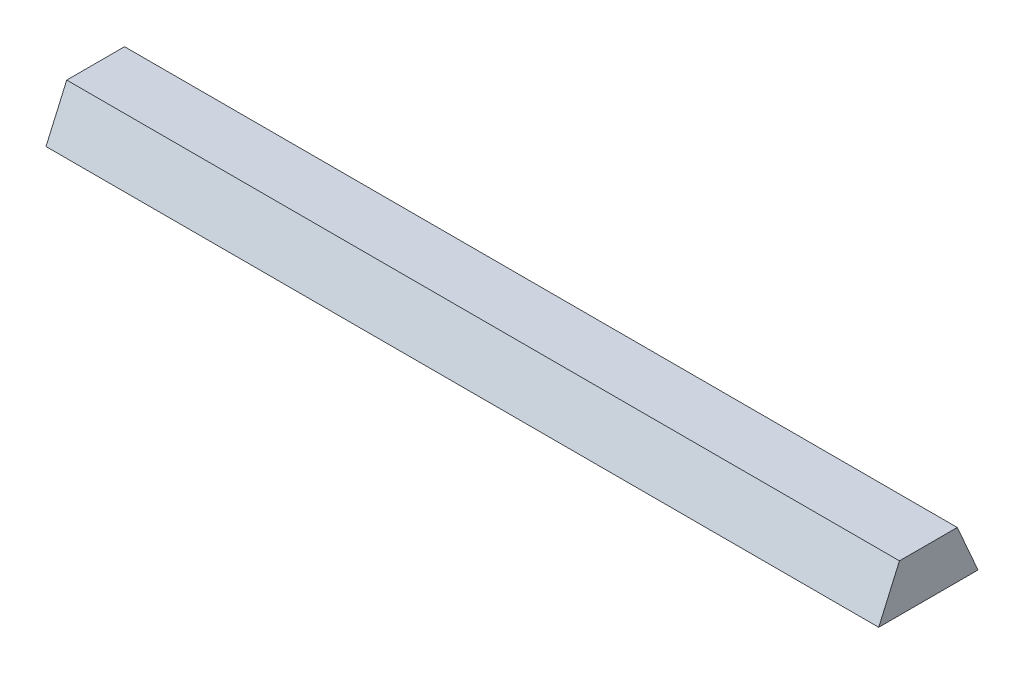
from build123d import *

# Parameters (mm, degrees)
SALIENTE_EXTRUIR1_DEPTH = 360


with BuildPart() as part:
    # Croquis1 → Saliente-Extruir1 (new body)
    with BuildSketch(Plane(origin=(0, 0, 0), x_dir=(0, 0, -1), z_dir=(1, 0, 0))):
        Polygon((-12.5, 20.406398165), (12.5, 20.406398165), (21.46, 0), (-21.46, 0), align=None)
    extrude(amount=SALIENTE_EXTRUIR1_DEPTH)


solid = part.part
